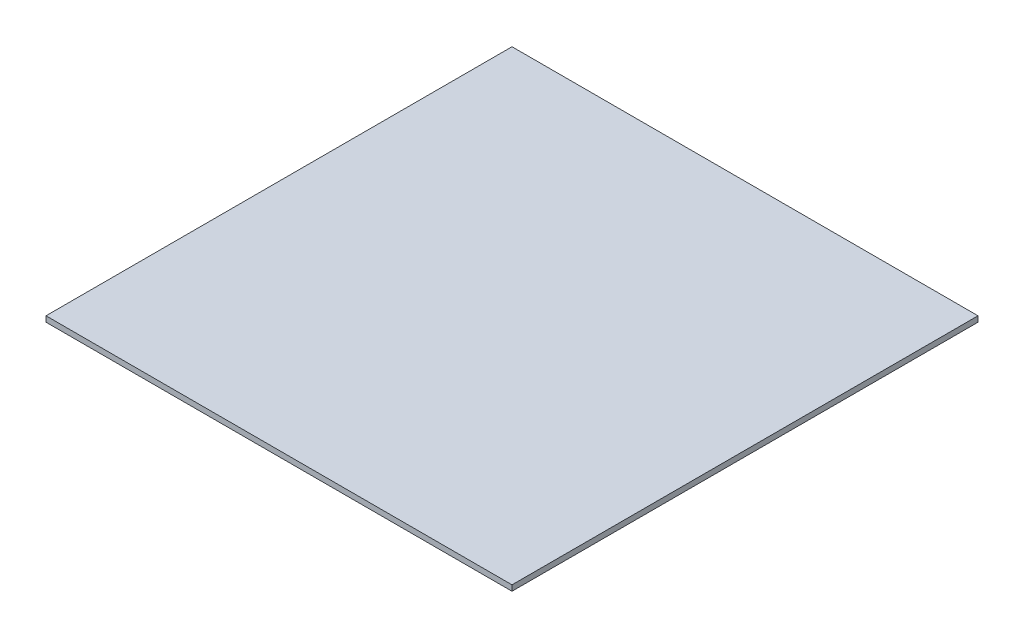
from build123d import *

# Parameters (mm, degrees)
SKETCH1_W           = 500
SKETCH1_H           = 500
BOSS_EXTRUDE1_DEPTH = 6


with BuildPart() as part:
    # Sketch1 → Boss-Extrude1 (new body)
    with BuildSketch(Plane(origin=(0, 0, 0), x_dir=(1, 0, 0), z_dir=(0, 1, 0))):
        with Locations((250, 250)):
            Rectangle(SKETCH1_W, SKETCH1_H)
    extrude(amount=BOSS_EXTRUDE1_DEPTH)


solid = part.part
